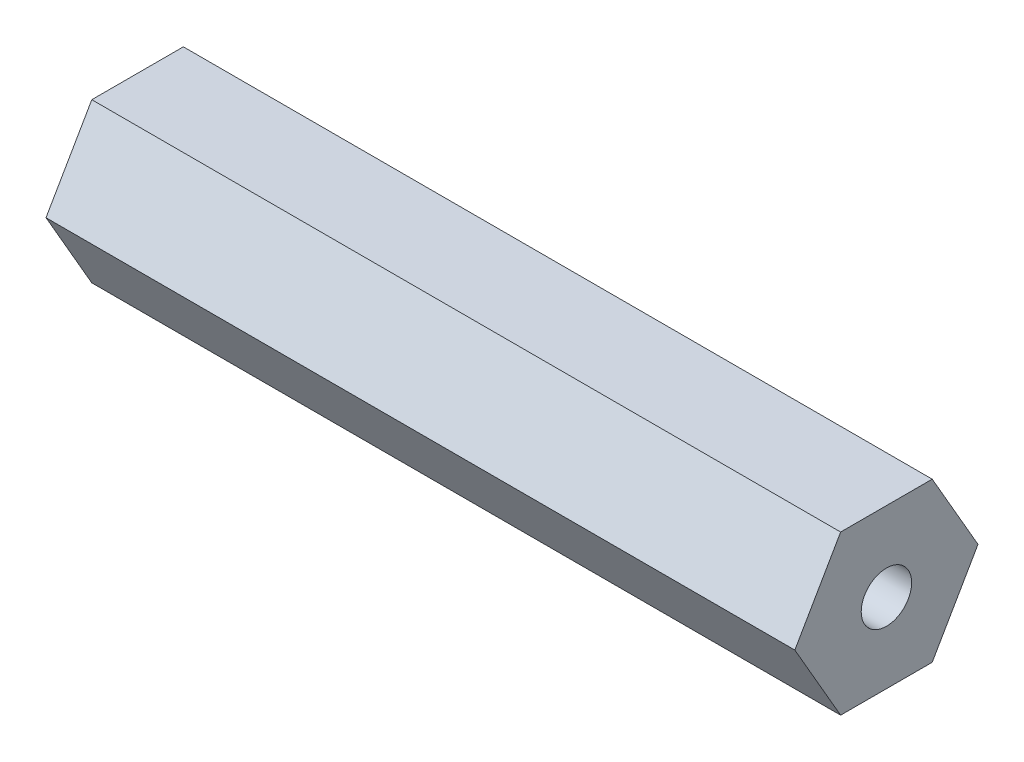
from build123d import *

# Parameters (mm, degrees)
SKETCH1_R           = 2.0193
BOSS_EXTRUDE1_DEPTH = 59.9567


with BuildPart() as part:
    # Sketch1 → Boss-Extrude1 (new body)
    with BuildSketch(Plane(origin=(0, 0, 0), x_dir=(0, 0, -1), z_dir=(1, 0, 0))):
        Polygon((7.332348419, 0), (3.666174209, 6.35), (-3.666174209, 6.35), (-7.332348419, 0), (-3.666174209, -6.35), (3.666174209, -6.35), align=None)
        with Locations(Location((0, 0, 0), (0, 0, 180))):
            Circle(SKETCH1_R, mode=Mode.SUBTRACT)
    extrude(amount=BOSS_EXTRUDE1_DEPTH)


solid = part.part
